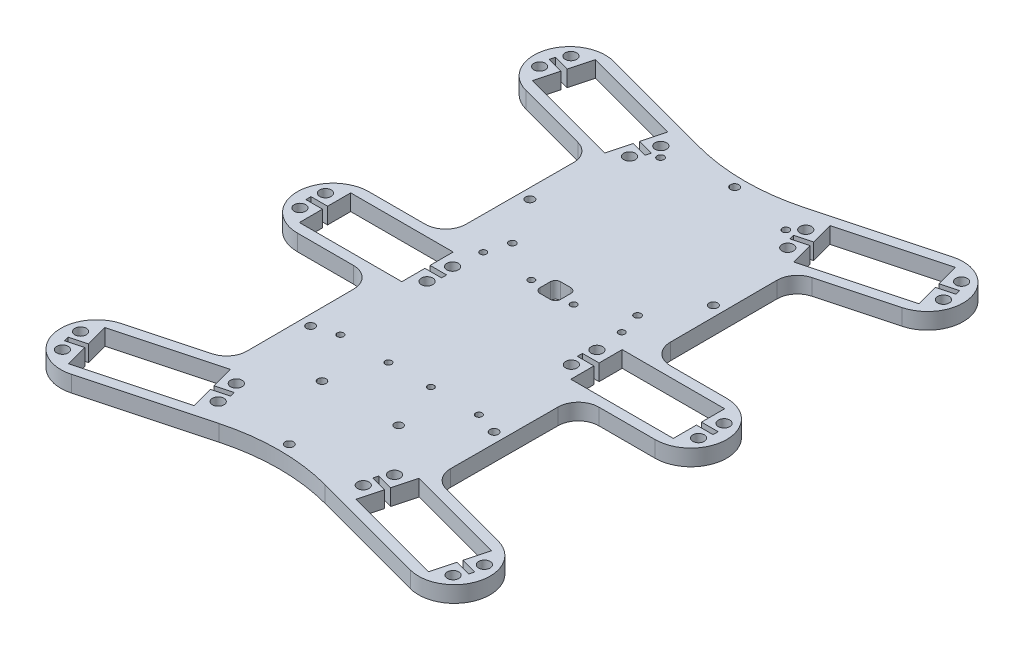
from build123d import *

# Parameters (mm, degrees)
SKETCH1_R           = 2.25
SKETCH1_W           = 40.1
SKETCH1_H           = 20.1
BOSS_EXTRUDE1_DEPTH = 6.35
FILLET1_R           = 80
FILLET2_R           = 8
SKETCH5_W           = 6.5
SKETCH5_H           = 2
CUT_EXTRUDE2_DEPTH  = 136.852736293
SKETCH6_R           = 1.25
SKETCH6_R_2         = 1.35
CUT_EXTRUDE3_DEPTH  = 10
SKETCH8_R           = 1.6
CUT_EXTRUDE5_DEPTH  = 10
SKETCH10_R          = 1.65
CUT_EXTRUDE6_DEPTH  = 10
SKETCH11_W          = 8
SKETCH11_H          = 8
CUT_EXTRUDE7_DEPTH  = 10
FILLET3_R           = 2


with BuildPart() as part:
    # Sketch1 → Boss-Extrude1 (new body)
    with BuildSketch(Plane(origin=(0, 0, 0), x_dir=(1, 0, 0), z_dir=(0, 1, 0))):
        with BuildLine():
            Line((-70, 14), (-40, 14))
            Line((-40, 14), (-39.816062711, 70))
            Line((-39.816062711, 70), (-73.623466631, 79.058666579))
            ThreePointArc((-73.623466631, 79.058666579), (-83.522961568, 96.205094778), (-66.376533369, 106.104589715))
            Line((-66.376533369, 106.104589715), (0, 88.319051202))
            Line((0, 88.319051202), (66.376533369, 106.104589715))
            ThreePointArc((66.376533369, 106.104589715), (83.522961568, 96.205094778), (73.623466631, 79.058666579))
            Line((73.623466631, 79.058666579), (39.816062711, 70))
            Line((39.816062711, 70), (40, 14))
            Line((40, 14), (70, 14))
            ThreePointArc((70, 14), (84, 0), (70, -14))
            Line((70, -14), (40, -14))
            Line((40, -14), (39.816062711, -70))
            Line((39.816062711, -70), (73.623466631, -79.058666579))
            ThreePointArc((73.623466631, -79.058666579), (83.522961568, -96.205094778), (66.376533369, -106.104589715))
            Line((66.376533369, -106.104589715), (0, -88.319051202))
            Line((0, -88.319051202), (-66.376533369, -106.104589715))
            ThreePointArc((-66.376533369, -106.104589715), (-83.522961568, -96.205094778), (-73.623466631, -79.058666579))
            Line((-73.623466631, -79.058666579), (-39.816062711, -70))
            Line((-39.816062711, -70), (-40, -14))
            Line((-40, -14), (-70, -14))
            ThreePointArc((-70, -14), (-84, 0), (-70, 14))
        make_face()
        with Locations(Location((-76.433311385, 99.481809639, 0), (0, 0, 270))):
            Circle(SKETCH1_R, mode=Mode.SUBTRACT)
        with Locations(Location((-79.021501836, 89.822551376, 0), (0, 0, 270))):
            Circle(SKETCH1_R, mode=Mode.SUBTRACT)
        with Locations(Location((-78, 5, 0), (0, 0, 270))):
            Circle(SKETCH1_R, mode=Mode.SUBTRACT)
        with Locations(Location((-79.021501836, -89.822551376, 0), (0, 0, 90))):
            Circle(SKETCH1_R, mode=Mode.SUBTRACT)
        with Locations(Location((-76.433311385, -99.481809639, 0), (0, 0, 90))):
            Circle(SKETCH1_R, mode=Mode.SUBTRACT)
        with Locations(Location((-78, -5, 0), (0, 0, 270))):
            Circle(SKETCH1_R, mode=Mode.SUBTRACT)
        with Locations(Location((78, -5, 0), (0, 0, 90))):
            Circle(SKETCH1_R, mode=Mode.SUBTRACT)
        with Locations(Location((76.433311385, -99.481809639, 0), (0, 0, 270))):
            Circle(SKETCH1_R, mode=Mode.SUBTRACT)
        with Locations(Location((79.021501836, -89.822551376, 0), (0, 0, 270))):
            Circle(SKETCH1_R, mode=Mode.SUBTRACT)
        with Locations(Location((78, 5, 0), (0, 0, 90))):
            Circle(SKETCH1_R, mode=Mode.SUBTRACT)
        with Locations(Location((79.021501836, 89.822551376, 0), (0, 0, 90))):
            Circle(SKETCH1_R, mode=Mode.SUBTRACT)
        with Locations(Location((76.433311385, 99.481809639, 0), (0, 0, 90))):
            Circle(SKETCH1_R, mode=Mode.SUBTRACT)
        with Locations(Location((-30.95703272, 76.943715692, 0), (0, 0, 90))):
            Circle(SKETCH1_R, mode=Mode.SUBTRACT)
        with Locations(Location((-28.368842269, 86.602973955, 0), (0, 0, 90))):
            Circle(SKETCH1_R, mode=Mode.SUBTRACT)
        with Locations(Location((-28.24, -5, 0), (0, 0, 90))):
            Circle(SKETCH1_R, mode=Mode.SUBTRACT)
        with Locations(Location((-28.24, 5, 0), (0, 0, 90))):
            Circle(SKETCH1_R, mode=Mode.SUBTRACT)
        with Locations(Location((-28.368842269, -86.602973955, 0), (0, 0, 270))):
            Circle(SKETCH1_R, mode=Mode.SUBTRACT)
        with Locations(Location((-30.95703272, -76.943715692, 0), (0, 0, 270))):
            Circle(SKETCH1_R, mode=Mode.SUBTRACT)
        with Locations(Location((28.368842269, 86.602973955, 0), (0, 0, 270))):
            Circle(SKETCH1_R, mode=Mode.SUBTRACT)
        with Locations(Location((30.95703272, 76.943715692, 0), (0, 0, 270))):
            Circle(SKETCH1_R, mode=Mode.SUBTRACT)
        with Locations(Location((28.24, 5, 0), (0, 0, 270))):
            Circle(SKETCH1_R, mode=Mode.SUBTRACT)
        with Locations(Location((28.24, -5, 0), (0, 0, 270))):
            Circle(SKETCH1_R, mode=Mode.SUBTRACT)
        with Locations(Location((30.95703272, -76.943715692, 0), (0, 0, 90))):
            Circle(SKETCH1_R, mode=Mode.SUBTRACT)
        with Locations(Location((28.368842269, -86.602973955, 0), (0, 0, 90))):
            Circle(SKETCH1_R, mode=Mode.SUBTRACT)
        Polygon((-70.460853466, 103.109639074), (-75.663116273, 83.694529965), (-36.929490638, 73.315886257), (-31.727227832, 92.730995365), align=None, mode=Mode.SUBTRACT)
        with Locations((-53.12, 0)):
            Rectangle(SKETCH1_W, SKETCH1_H, mode=Mode.SUBTRACT)
        Polygon((-36.929490638, -73.315886257), (-31.727227832, -92.730995365), (-70.460853466, -103.109639074), (-75.663116273, -83.694529965), align=None, mode=Mode.SUBTRACT)
        Polygon((36.929490638, 73.315886257), (31.727227832, 92.730995365), (70.460853466, 103.109639074), (75.663116273, 83.694529965), align=None, mode=Mode.SUBTRACT)
        with Locations((53.12, 0)):
            Rectangle(SKETCH1_W, SKETCH1_H, mode=Mode.SUBTRACT)
        Polygon((36.929490638, -73.315886257), (31.727227832, -92.730995365), (70.460853466, -103.109639074), (75.663116273, -83.694529965), align=None, mode=Mode.SUBTRACT)
    extrude(amount=BOSS_EXTRUDE1_DEPTH)

    # Fillet1
    fillet1_edges = [part.edges().sort_by_distance(p)[0] for p in [
        (0, 3.175, -88.319051202),
        (0, 3.175, 88.319051202),
    ]]
    fillet(fillet1_edges, radius=FILLET1_R)

    # Fillet2
    fillet2_edges = [part.edges().sort_by_distance(p)[0] for p in [
        (-40, 3.175, -14),
        (-39.816062711, 3.175, -70),
        (39.816062711, 3.175, -70),
        (40, 3.175, -14),
        (40, 3.175, 14),
        (39.816062711, 3.175, 70),
        (-39.816062711, 3.175, 70),
        (-40, 3.175, 14),
    ]]
    fillet(fillet2_edges, radius=FILLET2_R)

    # Sketch5 → Cut-Extrude2 (cut, through all)
    with BuildSketch(Plane(origin=(0, 6.35, 0), x_dir=(1, 0, 0), z_dir=(0, 1, 0))):
        with Locations((-29.82, 0)):
            Rectangle(SKETCH5_W, SKETCH5_H)
        with Locations((-76.42, 0)):
            Rectangle(SKETCH5_W, SKETCH5_H)
        Polygon((-34.06954019, 83.989366637), (-27.791022319, 82.307042844), (-28.308660409, 80.375191192), (-34.58717828, 82.057514985), align=None)
        Polygon((-72.803165824, 94.368010346), (-73.320803914, 92.436158693), (-79.599321785, 94.118482486), (-79.081683695, 96.050334139), align=None)
        Polygon((72.803165824, 94.368010346), (79.081683695, 96.050334139), (79.599321785, 94.118482486), (73.320803914, 92.436158693), align=None)
        Polygon((34.06954019, 83.989366637), (34.58717828, 82.057514985), (28.308660409, 80.375191192), (27.791022319, 82.307042844), align=None)
        with Locations((76.42, 0)):
            Rectangle(SKETCH5_W, SKETCH5_H)
        with Locations((29.82, 0)):
            Rectangle(SKETCH5_W, SKETCH5_H)
        Polygon((34.06954019, -83.989366637), (27.791022319, -82.307042844), (28.308660409, -80.375191192), (34.58717828, -82.057514985), align=None)
        Polygon((72.803165824, -94.368010346), (73.320803914, -92.436158693), (79.599321785, -94.118482486), (79.081683695, -96.050334139), align=None)
        Polygon((-72.803165824, -94.368010346), (-79.081683695, -96.050334139), (-79.599321785, -94.118482486), (-73.320803914, -92.436158693), align=None)
        Polygon((-34.06954019, -83.989366637), (-34.58717828, -82.057514985), (-28.308660409, -80.375191192), (-27.791022319, -82.307042844), align=None)
    extrude(amount=-CUT_EXTRUDE2_DEPTH, mode=Mode.SUBTRACT)

    # Sketch6 → Cut-Extrude3 (cut)
    with BuildSketch(Plane(origin=(0, 6.35, 0), x_dir=(1, 0, 0), z_dir=(0, 1, 0))):
        with Locations(Location((27.1, -40.058854365, 0), (0, 0, 270))):
            Circle(SKETCH6_R)
        with Locations(Location((8.3, -40.058854365, 0), (0, 0, 270))):
            Circle(SKETCH6_R)
        with Locations(Location((-8.3, -40.058854365, 0), (0, 0, 270))):
            Circle(SKETCH6_R)
        with Locations(Location((-27.1, -40.058854365, 0), (0, 0, 270))):
            Circle(SKETCH6_R)
        with Locations(Location((27.1, 15.841145635, 0), (0, 0, 270))):
            Circle(SKETCH6_R)
        with Locations(Location((-8.3, 15.841145635, 0), (0, 0, 270))):
            Circle(SKETCH6_R)
        with Locations(Location((-27.1, 15.841145635, 0), (0, 0, 270))):
            Circle(SKETCH6_R)
        with Locations(Location((-24.5, 24.641145635, 0), (0, 0, 270))):
            Circle(SKETCH6_R_2)
        with Locations(Location((24.5, 24.641145635, 0), (0, 0, 270))):
            Circle(SKETCH6_R_2)
        with Locations(Location((24.5, 82.641145635, 0), (0, 0, 270))):
            Circle(SKETCH6_R_2)
        with Locations(Location((-24.5, 82.641145635, 0), (0, 0, 270))):
            Circle(SKETCH6_R_2)
        with Locations(Location((8.3, 15.841145635, 0), (0, 0, 270))):
            Circle(SKETCH6_R)
    extrude(amount=-CUT_EXTRUDE3_DEPTH, mode=Mode.SUBTRACT)

    # Sketch8 → Cut-Extrude5 (cut)
    with BuildSketch(Plane(origin=(0, 6.35, 0), x_dir=(1, 0, 0), z_dir=(0, 1, 0))):
        with Locations(Location((15, -59.358854365, 0), (0, 0, 270))):
            Circle(SKETCH8_R)
        with Locations(Location((-15, -59.358854365, 0), (0, 0, 270))):
            Circle(SKETCH8_R)
    extrude(amount=-CUT_EXTRUDE5_DEPTH, mode=Mode.SUBTRACT)

    # Sketch10 → Cut-Extrude6 (cut)
    with BuildSketch(Plane(origin=(0, 6.35, 0), x_dir=(1, 0, 0), z_dir=(0, 1, 0))):
        with Locations(Location((-35.905030257, 42.907120147, 0), (0, 0, 270))):
            Circle(SKETCH10_R)
        with Locations(Location((0, 87.141145635, 0), (0, 0, 270))):
            Circle(SKETCH10_R)
        with Locations(Location((35.905030257, 42.907120147, 0), (0, 0, 270))):
            Circle(SKETCH10_R)
        with Locations(Location((35.905030257, -42.907120147, 0), (0, 0, 270))):
            Circle(SKETCH10_R)
        with Locations(Location((-35.905030257, -42.907120147, 0), (0, 0, 270))):
            Circle(SKETCH10_R)
        with Locations(Location((0, -87.141145635, 0), (0, 0, 270))):
            Circle(SKETCH10_R)
    extrude(amount=-CUT_EXTRUDE6_DEPTH, mode=Mode.SUBTRACT)

    # Sketch11 → Cut-Extrude7 (cut)
    with BuildSketch(Plane(origin=(0, 6.35, 0), x_dir=(1, 0, 0), z_dir=(0, 1, 0))):
        with Locations((0, 17)):
            Rectangle(SKETCH11_W, SKETCH11_H)
    extrude(amount=-CUT_EXTRUDE7_DEPTH, mode=Mode.SUBTRACT)

    # Fillet3
    fillet3_edges = [part.edges().sort_by_distance(p)[0] for p in [
        (4, 3.175, -21),
        (4, 3.175, -13),
        (-4, 3.175, -13),
        (-4, 3.175, -21),
    ]]
    fillet(fillet3_edges, radius=FILLET3_R)


solid = part.part
